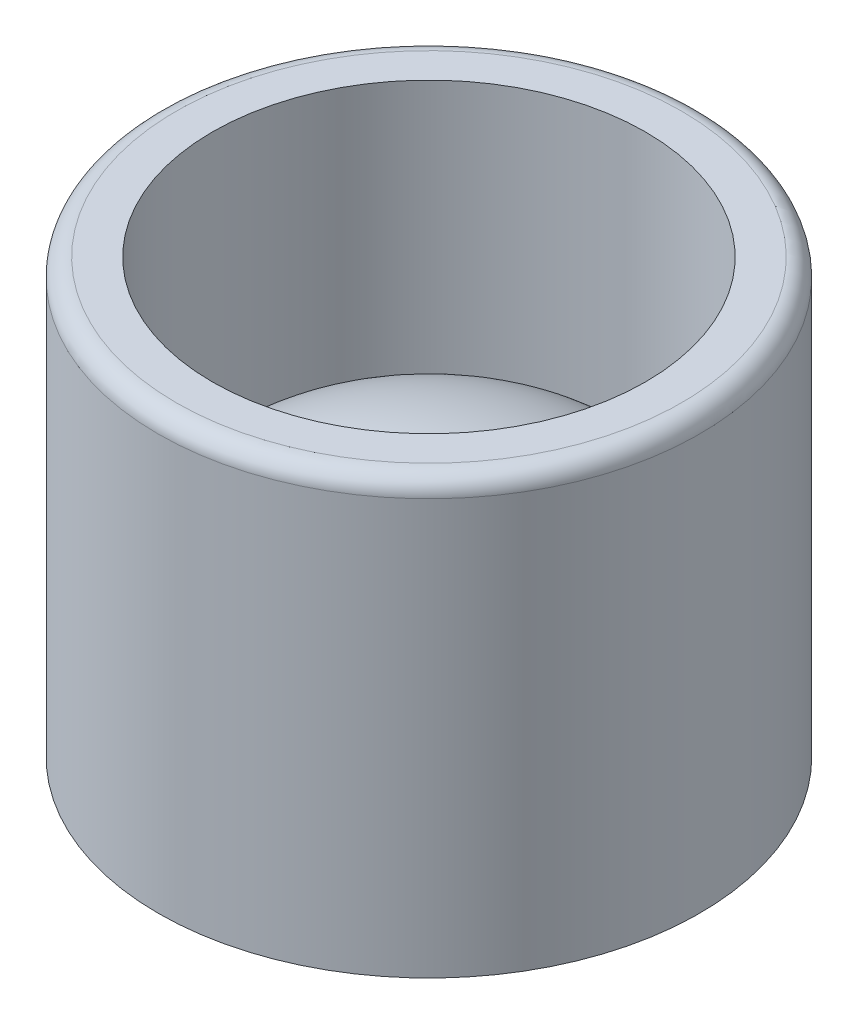
from build123d import *

# Parameters (mm, degrees)
SKETCH2_R           = 7.5
BOSS_EXTRUDE1_DEPTH = 12
SKETCH3_R           = 6
CUT_EXTRUDE1_DEPTH  = 8
DOME1_FACE_RADIUS   = 6
DOME1_HEIGHT        = 3
FILLET1_R           = 0.5


with BuildPart() as part:
    # Sketch2 → Boss-Extrude1 (new body)
    with BuildSketch(Plane(origin=(0, 0, 0), x_dir=(1, 0, 0), z_dir=(0, 1, 0))):
        with Locations(Location((0, 0, 0), (0, 0, 270))):
            Circle(SKETCH2_R)
    extrude(amount=BOSS_EXTRUDE1_DEPTH)

    # Sketch3 → Cut-Extrude1 (cut)
    with BuildSketch(Plane(origin=(0, 12, 0), x_dir=(1, 0, 0), z_dir=(0, 1, 0))):
        with Locations(Location((0, 0, 0), (0, 0, 270))):
            Circle(SKETCH3_R)
    extrude(amount=-CUT_EXTRUDE1_DEPTH, mode=Mode.SUBTRACT)

    # Dome1: an elliptical dome of height H over a round flat face of radius A is half a spheroid: the quarter ellipse of half axes A and H revolved about the face's axis
    with BuildSketch(Plane((0, 4, 0), x_dir=(0, 0, -1), z_dir=(1, 0, 0)), mode=Mode.PRIVATE) as dome1_quarter:
        Ellipse(DOME1_FACE_RADIUS, DOME1_HEIGHT)
        Rectangle(DOME1_FACE_RADIUS, DOME1_HEIGHT, align=(Align.MIN, Align.MIN), mode=Mode.INTERSECT)
    revolve(dome1_quarter.sketch, axis=Axis((0, 4, 0), (0, 1, 0)))

    # Fillet1
    fillet1_edges = [part.edges().sort_by_distance(p)[0] for p in [
        (0, 12, -7.5),
    ]]
    fillet(fillet1_edges, radius=FILLET1_R)


solid = part.part
